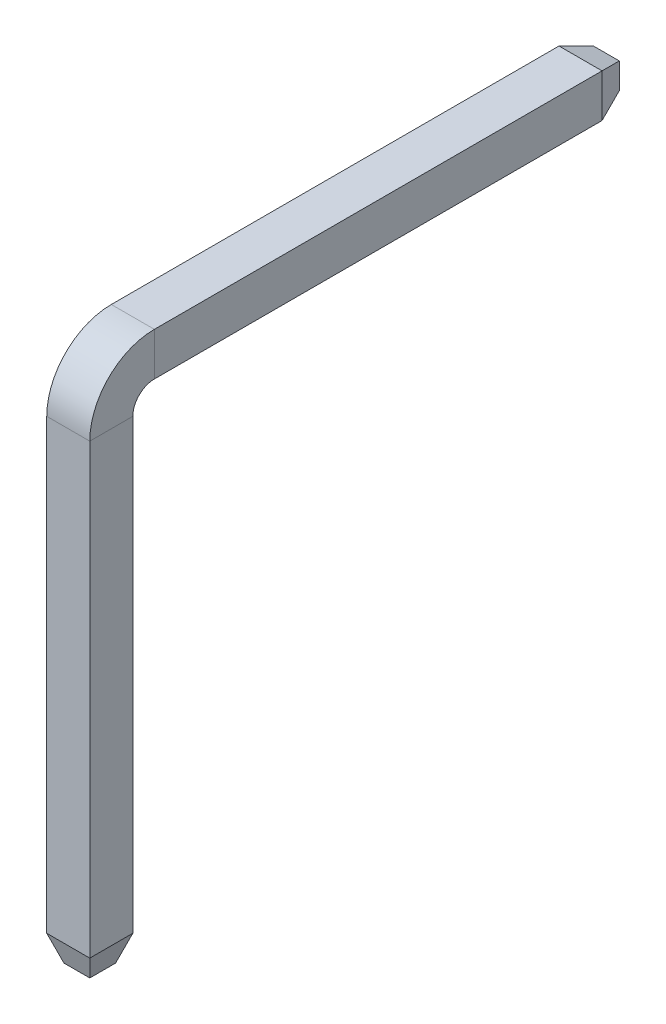
from build123d import *
from OCP.BRepFilletAPI import BRepFilletAPI_MakeChamfer

# Parameters (mm, degrees)
ESBO_O2_W      = 0.5
ESBO_O2_H      = 0.5
CHANFRO1_SIZE  = 0.1
CHANFRO1_SIZE2 = 0.3
CHANFRO2_SIZE  = 0.3
CHANFRO2_SIZE2 = 0.1


with BuildPart() as part:
    # Varredura1: sweep along a path in Esboço1
    with BuildLine(Plane(origin=(0, 0, 0), x_dir=(0, 0, -1), z_dir=(1, 0, 0))) as varredura1_path:
        Line((0, 0), (-5.5, 0))
        ThreePointArc((-5.5, 0), (-5.853553391, -0.146446609), (-6, -0.5))
        Line((-6, -0.5), (-6, -6))
    # Esboço2 → Varredura1 (sweep)
    with BuildSketch(Plane.XY):
        Rectangle(ESBO_O2_W, ESBO_O2_H)
    sweep(path=varredura1_path.line)

    # Chanfro1
    chanfro1_edges = [part.edges().sort_by_distance(p)[0] for p in [
        (0, 0.25, 0),
        (-0.25, 0, 0),
        (0, -0.25, 0),
        (0.25, 0, 0),
    ]]
    chanfro1_side = [part.faces().sort_by_distance(p)[0] for p in [
        (0, 0, 0),
    ]]
    chamfer(chanfro1_edges, length=CHANFRO1_SIZE, length2=CHANFRO1_SIZE2, reference=chanfro1_side[0])

    # Chanfro2: one chamfer whose edges measure the first distance from different faces: ONE call of the kernel's chamfer builder (chamfer() names one face for all edges)
    chanfro2_edges_1 = [part.edges().sort_by_distance(p)[0] for p in [
        (0.25, -6, 6),
    ]]
    chanfro2_side_1 = [part.faces().sort_by_distance(p)[0] for p in [
        (0.25, -0.163706895, 2.9),
    ]]
    chanfro2_edges_2 = [part.edges().sort_by_distance(p)[0] for p in [
        (0, -6, 6.25),
    ]]
    chanfro2_side_2 = [part.faces().sort_by_distance(p)[0] for p in [
        (0, -3.25, 6.25),
    ]]
    chanfro2_edges_3 = [part.edges().sort_by_distance(p)[0] for p in [
        (-0.25, -6, 6),
    ]]
    chanfro2_side_3 = [part.faces().sort_by_distance(p)[0] for p in [
        (-0.25, 0.163706895, 2.9),
    ]]
    chanfro2_edges_4 = [part.edges().sort_by_distance(p)[0] for p in [
        (0, -6, 5.75),
    ]]
    chanfro2_side_4 = [part.faces().sort_by_distance(p)[0] for p in [
        (0, -3.25, 5.75),
    ]]
    chanfro2 = BRepFilletAPI_MakeChamfer(part.part.solid().wrapped)
    for e in chanfro2_edges_1:
        chanfro2.Add(CHANFRO2_SIZE, CHANFRO2_SIZE2, e.wrapped, chanfro2_side_1[0].wrapped)  # the first distance lies on this face
    for e in chanfro2_edges_2:
        chanfro2.Add(CHANFRO2_SIZE, CHANFRO2_SIZE2, e.wrapped, chanfro2_side_2[0].wrapped)  # the first distance lies on this face
    for e in chanfro2_edges_3:
        chanfro2.Add(CHANFRO2_SIZE, CHANFRO2_SIZE2, e.wrapped, chanfro2_side_3[0].wrapped)  # the first distance lies on this face
    for e in chanfro2_edges_4:
        chanfro2.Add(CHANFRO2_SIZE, CHANFRO2_SIZE2, e.wrapped, chanfro2_side_4[0].wrapped)  # the first distance lies on this face
    add(Compound.cast(chanfro2.Shape()), mode=Mode.REPLACE)


solid = part.part
